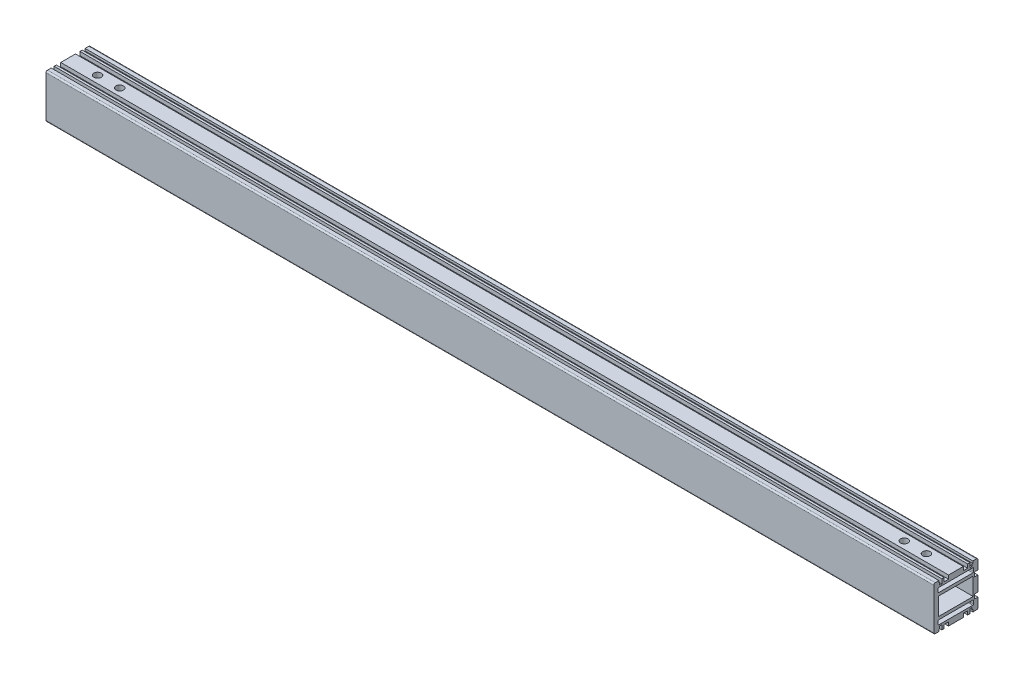
from build123d import *

# Parameters (mm, degrees)
SKETCH_1_W             = 23.5
SKETCH_1_H             = 12
EXTRUDE_1_DEPTH        = 301
HOLE_WIZARD_M6_1_D     = 5
HOLE_WIZARD_M6_1_DEPTH = 15
HOLE_WIZARD_M6_1_TIP   = 1.502151548
HOLE_WIZARD_M6_2_D     = 5
HOLE_WIZARD_M6_2_DEPTH = 15
HOLE_WIZARD_M6_2_TIP   = 1.502151548
HOLE_WIZARD_M4_1_D     = 3.3
HOLE_WIZARD_M4_1_DEPTH = 10.1
HOLE_WIZARD_M4_1_TIP   = 0.991420021


with BuildPart() as part:
    # 草图1 → 凸台-拉伸1 (new, symmetric)
    with BuildSketch(Plane(origin=(0, 0, 0), x_dir=(0, 0, -1), z_dir=(1, 0, 0))):
        with BuildLine():
            Line((-14, 15), (-11.5, 15))
            Line((-11.5, 15), (-11.5, 13.5))
            Line((-11.5, 13.5), (-11.4, 13.5))
            ThreePointArc((-11.4, 13.5), (-11.117157288, 13.382842712), (-11, 13.1))
            Line((-11, 13.1), (-11, 12))
            Line((-11, 12), (-9.5, 12))
            Line((-9.5, 12), (-9.5, 15))
            Line((-9.5, 15), (-8, 15))
            Line((-8, 15), (-8, 12.5))
            Line((-8, 12.5), (-5, 12.5))
            Line((-5, 12.5), (-5, 15))
            Line((-5, 15), (5, 15))
            Line((5, 15), (5, 12.5))
            Line((5, 12.5), (8, 12.5))
            Line((8, 12.5), (8, 15))
            Line((8, 15), (9.5, 15))
            Line((9.5, 15), (9.5, 12))
            Line((9.5, 12), (11, 12))
            Line((11, 12), (11, 13.1))
            ThreePointArc((11, 13.1), (11.117157288, 13.382842712), (11.4, 13.5))
            Line((11.4, 13.5), (11.5, 13.5))
            Line((11.5, 13.5), (11.5, 15))
            Line((11.5, 15), (14, 15))
            ThreePointArc((14, 15), (14.707106781, 14.707106781), (15, 14))
            Line((15, 14), (15, 8))
            Line((15, 8), (12.5, 8))
            Line((12.5, 8), (12.5, 5))
            Line((12.5, 5), (15, 5))
            Line((15, 5), (15, -5))
            Line((15, -5), (12.5, -5))
            Line((12.5, -5), (12.5, -8))
            Line((12.5, -8), (15, -8))
            Line((15, -8), (15, -14))
            ThreePointArc((15, -14), (14.707106781, -14.707106781), (14, -15))
            Line((14, -15), (11.5, -15))
            Line((11.5, -15), (11.5, -13.5))
            Line((11.5, -13.5), (11.4, -13.5))
            ThreePointArc((11.4, -13.5), (11.117157288, -13.382842712), (11, -13.1))
            Line((11, -13.1), (11, -12))
            Line((11, -12), (9.5, -12))
            Line((9.5, -12), (9.5, -15))
            Line((9.5, -15), (8, -15))
            Line((8, -15), (8, -12.5))
            Line((8, -12.5), (5, -12.5))
            Line((5, -12.5), (5, -15))
            Line((5, -15), (-5, -15))
            Line((-5, -15), (-5, -12.5))
            Line((-5, -12.5), (-8, -12.5))
            Line((-8, -12.5), (-8, -15))
            Line((-8, -15), (-9.5, -15))
            Line((-9.5, -15), (-9.5, -12))
            Line((-9.5, -12), (-11, -12))
            Line((-11, -12), (-11, -13.1))
            ThreePointArc((-11, -13.1), (-11.117157288, -13.382842712), (-11.4, -13.5))
            Line((-11.4, -13.5), (-11.5, -13.5))
            Line((-11.5, -13.5), (-11.5, -15))
            Line((-11.5, -15), (-14, -15))
            ThreePointArc((-14, -15), (-14.707106781, -14.707106781), (-15, -14))
            Line((-15, -14), (-15, 14))
            ThreePointArc((-15, 14), (-14.707106781, 14.707106781), (-14, 15))
        make_face()
        with BuildLine():
            Line((12, -10.5), (12, -8.5))
            ThreePointArc((12, -8.5), (11.853553391, -8.146446609), (11.5, -8))
            Line((11.5, -8), (-11.5, -8))
            ThreePointArc((-11.5, -8), (-11.853553391, -8.146446609), (-12, -8.5))
            Line((-12, -8.5), (-12, -10.5))
            ThreePointArc((-12, -10.5), (-11.853553391, -10.853553391), (-11.5, -11))
            Line((-11.5, -11), (11.5, -11))
            ThreePointArc((11.5, -11), (11.853553391, -10.853553391), (12, -10.5))
        make_face(mode=Mode.SUBTRACT)
        with BuildLine():
            Line((-11.5, 11), (11.5, 11))
            ThreePointArc((11.5, 11), (11.853553391, 10.853553391), (12, 10.5))
            Line((12, 10.5), (12, 8.5))
            ThreePointArc((12, 8.5), (11.853553391, 8.146446609), (11.5, 8))
            Line((11.5, 8), (-11.5, 8))
            ThreePointArc((-11.5, 8), (-11.853553391, 8.146446609), (-12, 8.5))
            Line((-12, 8.5), (-12, 10.5))
            ThreePointArc((-12, 10.5), (-11.853553391, 10.853553391), (-11.5, 11))
        make_face(mode=Mode.SUBTRACT)
        Rectangle(SKETCH_1_W, SKETCH_1_H, mode=Mode.SUBTRACT)
    extrude(amount=EXTRUDE_1_DEPTH, both=True)

    # M6 螺纹孔1
    with Locations(Plane(origin=(0, 0, -15), x_dir=(-1, 0, 0), z_dir=(0, 0, -1))):
        with Locations((-281, 0), (-266, 0), (29, 0), (14, 0), (99, 0), (114, 0)):
            Hole(HOLE_WIZARD_M6_1_D / 2, depth=HOLE_WIZARD_M6_1_DEPTH)
            with Locations((0, 0, -(HOLE_WIZARD_M6_1_DEPTH + HOLE_WIZARD_M6_1_TIP / 2))):  # 118° drill point
                Cone(0, HOLE_WIZARD_M6_1_D / 2, HOLE_WIZARD_M6_1_TIP, mode=Mode.SUBTRACT)

    # M6 螺纹孔2
    with Locations(Plane(origin=(0, 15, 0), x_dir=(-1, 0, 0), z_dir=(0, 1, 0))):
        with Locations((281, 0), (266, 0), (-266, 0), (-281, 0)):
            Hole(HOLE_WIZARD_M6_2_D / 2, depth=HOLE_WIZARD_M6_2_DEPTH)
            with Locations((0, 0, -(HOLE_WIZARD_M6_2_DEPTH + HOLE_WIZARD_M6_2_TIP / 2))):  # 118° drill point
                Cone(0, HOLE_WIZARD_M6_2_D / 2, HOLE_WIZARD_M6_2_TIP, mode=Mode.SUBTRACT)

    # M4 螺纹孔1
    with Locations(Plane(origin=(0, 0, -15), x_dir=(-1, 0, 0), z_dir=(0, 0, -1))):
        with Locations((-96, 0), (-231, 0)):
            Hole(HOLE_WIZARD_M4_1_D / 2, depth=HOLE_WIZARD_M4_1_DEPTH)
            with Locations((0, 0, -(HOLE_WIZARD_M4_1_DEPTH + HOLE_WIZARD_M4_1_TIP / 2))):  # 118° drill point
                Cone(0, HOLE_WIZARD_M4_1_D / 2, HOLE_WIZARD_M4_1_TIP, mode=Mode.SUBTRACT)


solid = part.part
